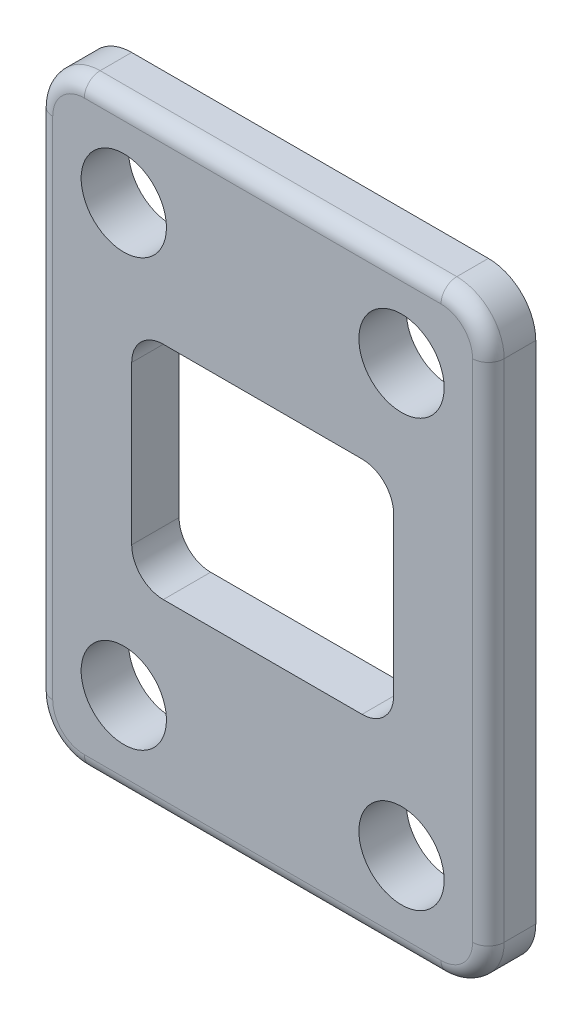
from build123d import *

# Parameters (mm, degrees)
SKETCH_1_R      = 1.35
EXTRUDE_2_DEPTH = 1.5
FILLET_1_R      = 0.5


with BuildPart() as part:
    # 草图1 → 凸台-拉伸2 (new body)
    with BuildSketch(Plane.XY):
        with BuildLine():
            Line((97.519773553, 11.5), (86.228033822, 11.5))
            ThreePointArc((86.228033822, 11.5), (85.16737365, 11.060660172), (84.728033822, 10))
            Line((84.728033822, 10), (84.728033822, 7))
            Line((84.728033822, 7), (84.728033822, -3))
            Line((84.728033822, -3), (84.728033822, -6))
            ThreePointArc((84.728033822, -6), (85.16737365, -7.060660172), (86.228033822, -7.5))
            Line((86.228033822, -7.5), (97.519773553, -7.5))
            ThreePointArc((97.519773553, -7.5), (98.580433725, -7.060660172), (99.019773553, -6))
            Line((99.019773553, -6), (99.019773553, -3))
            Line((99.019773553, -3), (99.019773553, 7))
            Line((99.019773553, 7), (99.019773553, 10))
            ThreePointArc((99.019773553, 10), (98.580433725, 11.060660172), (97.519773553, 11.5))
        make_face()
        with Locations((87.478033822, -4.75)):
            Circle(SKETCH_1_R, mode=Mode.SUBTRACT)
        with Locations((96.269773553, -4.75)):
            Circle(SKETCH_1_R, mode=Mode.SUBTRACT)
        with Locations((96.269773553, 8.75)):
            Circle(SKETCH_1_R, mode=Mode.SUBTRACT)
        with Locations((87.478033822, 8.75)):
            Circle(SKETCH_1_R, mode=Mode.SUBTRACT)
        with BuildLine():
            Line((88.728033822, 5.5), (95.019773553, 5.5))
            ThreePointArc((95.019773553, 5.5), (95.726880334, 5.207106781), (96.019773553, 4.5))
            Line((96.019773553, 4.5), (96.019773553, -0.5))
            ThreePointArc((96.019773553, -0.5), (95.726880334, -1.207106781), (95.019773553, -1.5))
            Line((95.019773553, -1.5), (88.728033822, -1.5))
            ThreePointArc((88.728033822, -1.5), (88.020927041, -1.207106781), (87.728033822, -0.5))
            Line((87.728033822, -0.5), (87.728033822, 4.5))
            ThreePointArc((87.728033822, 4.5), (88.020927041, 5.207106781), (88.728033822, 5.5))
        make_face(mode=Mode.SUBTRACT)
    extrude(amount=EXTRUDE_2_DEPTH)

    # 圆角1
    fillet_1_edges = [part.edges().sort_by_distance(p)[0] for p in [
        (85.16737365, 11.060660172, 1.5),
        (84.728033822, 2, 1.5),
        (85.16737365, -7.060660172, 1.5),
        (91.873903688, -7.5, 1.5),
        (98.580433725, -7.060660172, 1.5),
        (99.019773553, 2, 1.5),
        (98.580433725, 11.060660172, 1.5),
        (91.873903688, 11.5, 1.5),
    ]]
    fillet(fillet_1_edges, radius=FILLET_1_R)


solid = part.part
